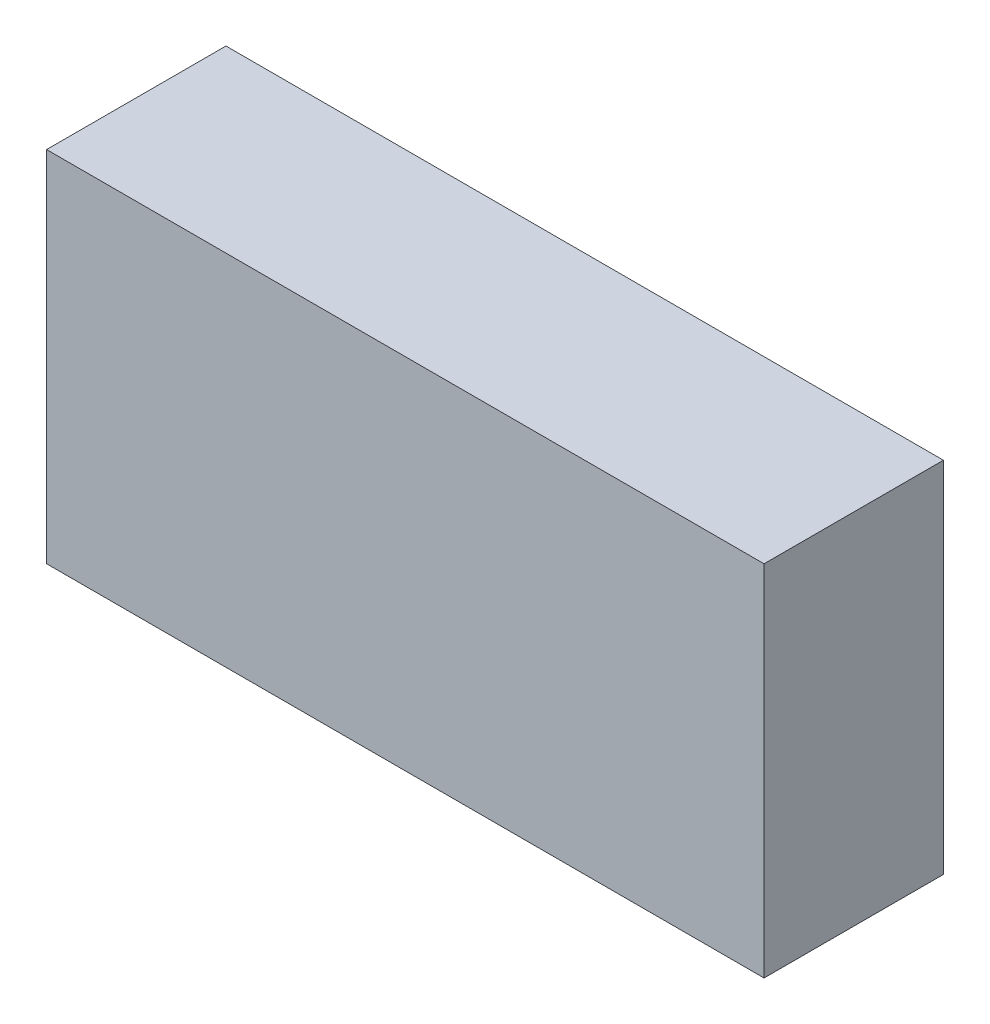
from build123d import *

# Parameters (mm, degrees)
SKETCH1_W           = 40
SKETCH1_H           = 20
BOSS_EXTRUDE1_DEPTH = 10
SKETCH2_W           = 6
SKETCH2_H           = 6
BOSS_EXTRUDE2_DEPTH = 5
SKETCH3_W           = 6
SKETCH3_H           = 6
BOSS_EXTRUDE3_DEPTH = 6
SKETCH4_W           = 6
SKETCH4_H           = 6
BOSS_EXTRUDE4_DEPTH = 7


with BuildPart() as part:
    # Sketch1 → Boss-Extrude1 (new body)
    with BuildSketch(Plane.XY):
        Rectangle(SKETCH1_W, SKETCH1_H)
    extrude(amount=BOSS_EXTRUDE1_DEPTH)

    # Sketch2 → Boss-Extrude2 (add)
    with BuildSketch(Plane.XY):
        with Locations((-15, -2)):
            Rectangle(SKETCH2_W, SKETCH2_H)
    extrude(amount=BOSS_EXTRUDE2_DEPTH)

    # Sketch3 → Boss-Extrude3 (add)
    with BuildSketch(Plane.XY):
        with Locations((-6, -2)):
            Rectangle(SKETCH3_W, SKETCH3_H)
    extrude(amount=BOSS_EXTRUDE3_DEPTH)

    # Sketch4 → Boss-Extrude4 (add)
    with BuildSketch(Plane.XY):
        with Locations((3, -2)):
            Rectangle(SKETCH4_W, SKETCH4_H)
    extrude(amount=BOSS_EXTRUDE4_DEPTH)


solid = part.part
